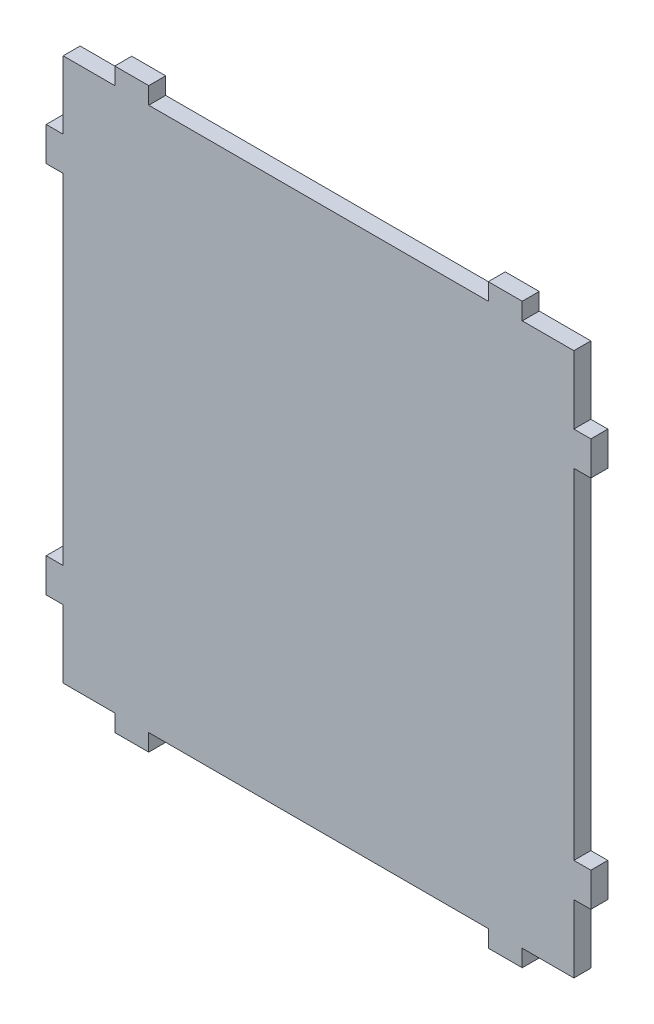
from build123d import *

# Parameters (mm, degrees)
BOSS_EXTRUDE1_DEPTH = 3.175


with BuildPart() as part:
    # Sketch1 → Boss-Extrude1 (new body)
    with BuildSketch(Plane.XY):
        Polygon((16.002, 0), (79.502, 0), (79.502, 3.175), (85.852, 3.175), (85.852, 0), (95.504, 0), (95.504, -12.7), (98.679, -12.7), (98.679, -19.05), (95.504, -19.05), (95.504, -82.55), (98.679, -82.55), (98.679, -88.9), (95.504, -88.9), (95.504, -101.6), (85.852, -101.6), (85.852, -104.775), (79.502, -104.775), (79.502, -101.6), (16.002, -101.6), (16.002, -104.775), (9.652, -104.775), (9.652, -101.6), (0, -101.6), (0, -88.9), (-3.175, -88.9), (-3.175, -82.55), (0, -82.55), (0, -19.05), (-3.175, -19.05), (-3.175, -12.7), (0, -12.7), (0, 0), (9.652, 0), (9.652, 3.175), (16.002, 3.175), align=None)
    extrude(amount=BOSS_EXTRUDE1_DEPTH)


solid = part.part
